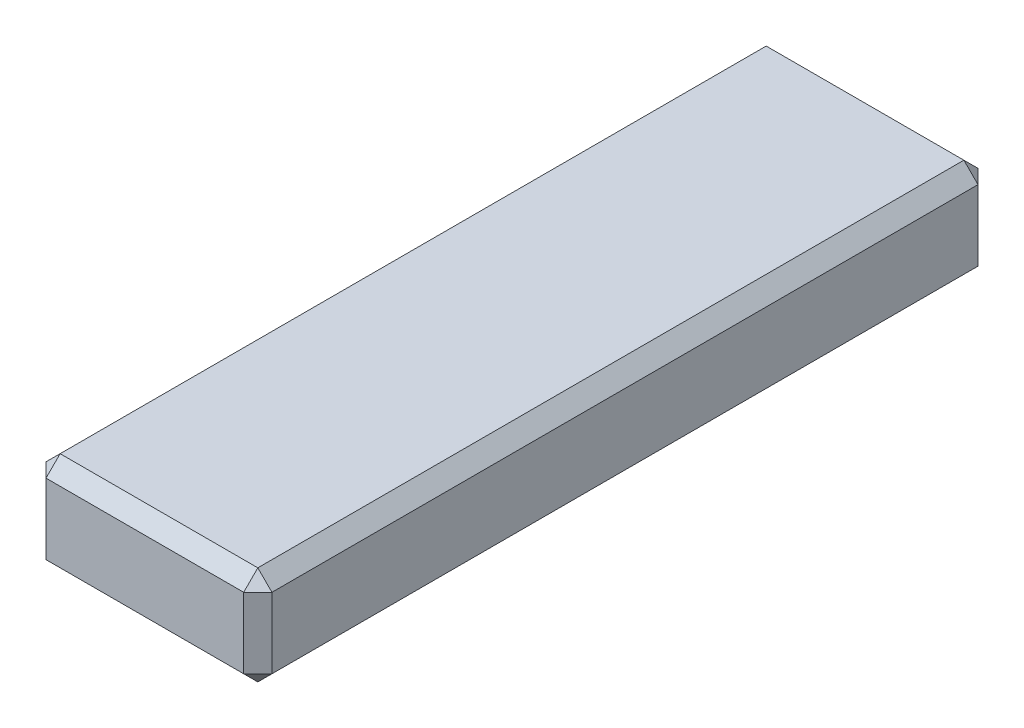
from build123d import *

# Parameters (mm, degrees)
SKETCH1_W           = 8
SKETCH1_H           = 3.5
BOSS_EXTRUDE1_DEPTH = 5
SKETCH2_W           = 8
SKETCH2_H           = 3.5
BOSS_EXTRUDE2_DEPTH = 8
CHAMFER1_SIZE       = 0.5


with BuildPart() as part:
    # Sketch1 → Boss-Extrude1 (new, symmetric)
    with BuildSketch(Plane.XY):
        Rectangle(SKETCH1_W, SKETCH1_H)
    extrude(amount=BOSS_EXTRUDE1_DEPTH, both=True)

    # Sketch2 → Boss-Extrude2 (add)
    with BuildSketch(Plane(origin=(0, 0, -5), x_dir=(-1, 0, 0), z_dir=(0, 0, -1))):
        Rectangle(SKETCH2_W, SKETCH2_H)
    boss_extrude2 = extrude(amount=BOSS_EXTRUDE2_DEPTH)

    # Mirror1: Boss-Extrude2 across plane
    add(boss_extrude2.mirror(Plane.XY))

    # Chamfer1
    chamfer1_edges = [part.edges().sort_by_distance(p)[0] for p in [
        (-4, 0, -13),
        (0, 1.75, -13),
        (4, 0, -13),
        (0, -1.75, -13),
        (-4, 0, 13),
        (0, -1.75, 13),
        (4, 0, 13),
        (0, 1.75, 13),
        (4, -1.75, 0),
        (-4, -1.75, 0),
        (-4, 1.75, 0),
        (4, 1.75, 0),
    ]]
    chamfer(chamfer1_edges, length=CHAMFER1_SIZE)


solid = part.part
